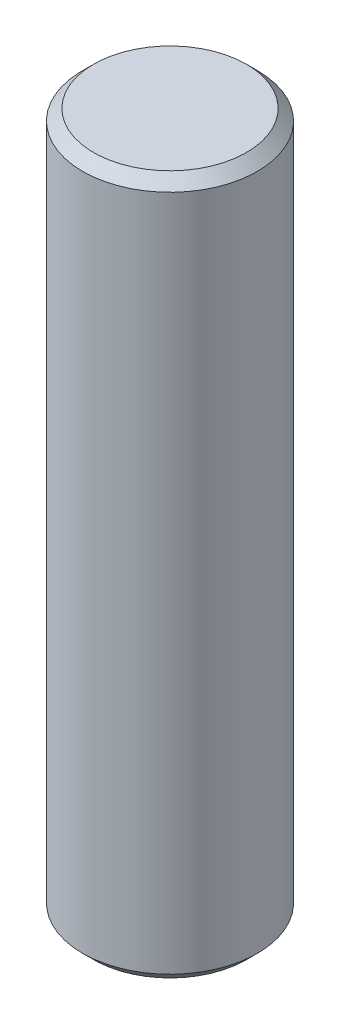
from build123d import *


with BuildPart() as part:
    # Sketch1 → Revolve1 (revolve)
    with BuildSketch(Plane.YZ, mode=Mode.PRIVATE) as revolve1_sk:
        Polygon((-12.7, 0), (12.7, 0), (12.7, 2.77876), (12.30376, 3.175), (-12.30376, 3.175), (-12.7, 2.77876), align=None)
    revolve(revolve1_sk.sketch.rotate(Axis((0, -12.7, 0), (0, 1, 0)), 180), axis=Axis((0, -12.7, 0), (0, 1, 0)))


solid = part.part
